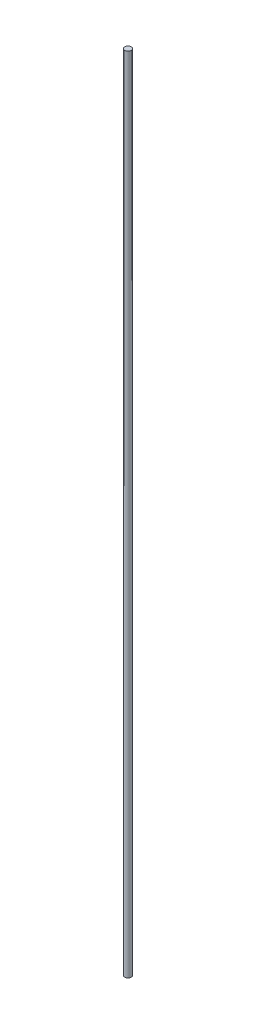
from build123d import *

# Parameters (mm, degrees)
SKETCH1_R           = 4
BOSS_EXTRUDE1_DEPTH = 500


with BuildPart() as part:
    # Sketch1 → Boss-Extrude1 (new, symmetric)
    with BuildSketch(Plane(origin=(0, 0, 0), x_dir=(1, 0, 0), z_dir=(0, 1, 0))):
        with Locations(Location((0, 0, 0), (0, 0, 270))):
            Circle(SKETCH1_R)
    extrude(amount=BOSS_EXTRUDE1_DEPTH, both=True)


solid = part.part
